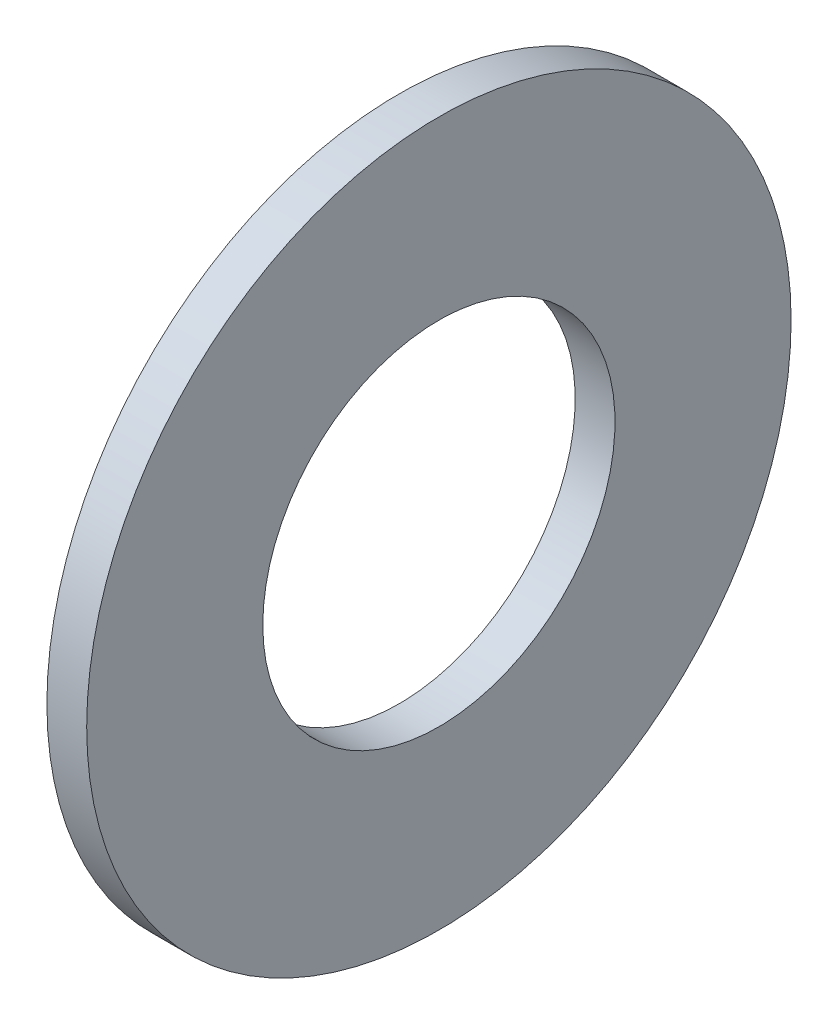
from build123d import *

# Parameters (mm, degrees)
SKETCH1_R           = 13.4874
SKETCH1_R_2         = 6.7437
BOSS_EXTRUDE2_DEPTH = 1.524


with BuildPart() as part:
    # Sketch1 → Boss-Extrude2 (new body)
    with BuildSketch(Plane(origin=(0, 0, 0), x_dir=(0, 0, -1), z_dir=(1, 0, 0))):
        with Locations(Location((0, 0, 0), (0, 0, 180))):
            Circle(SKETCH1_R)
        with Locations(Location((0, 0, 0), (0, 0, 180))):
            Circle(SKETCH1_R_2, mode=Mode.SUBTRACT)
    extrude(amount=BOSS_EXTRUDE2_DEPTH)


solid = part.part
